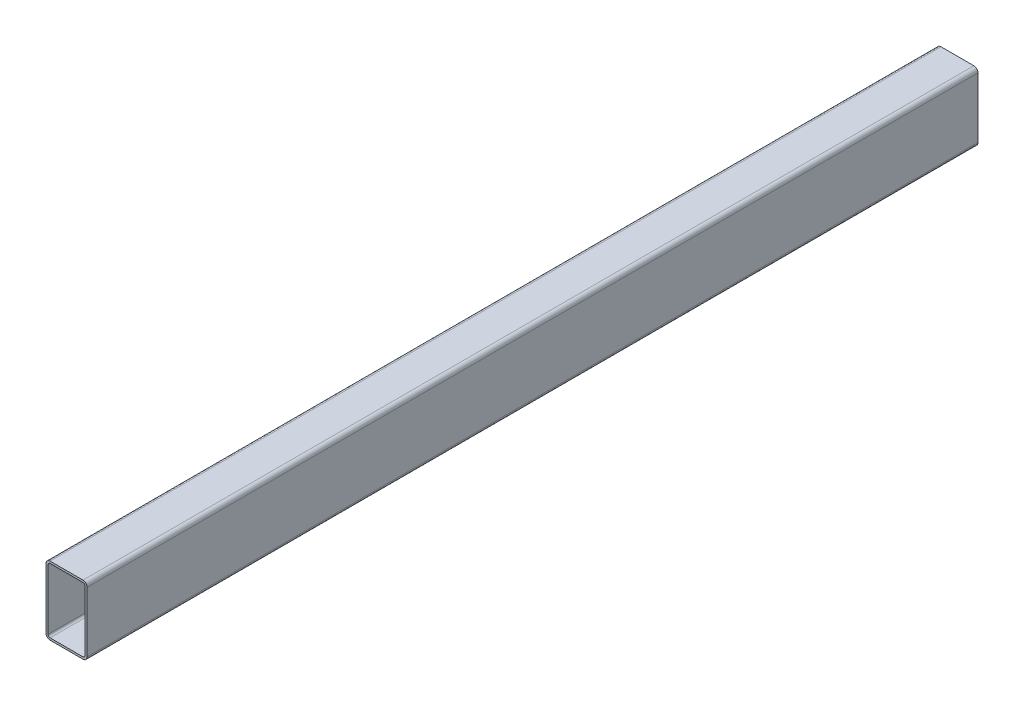
from build123d import *

# Parameters (mm, degrees)
BOSS_EXTRUDE1_DEPTH = 650


with BuildPart() as part:
    # Sketch1 → Boss-Extrude1 (new, symmetric)
    with BuildSketch(Plane.XY):
        with BuildLine():
            Line((-24, -50), (24, -50))
            ThreePointArc((24, -50), (28.242640687, -48.242640687), (30, -44))
            Line((30, -44), (30, 44))
            ThreePointArc((30, 44), (28.242640687, 48.242640687), (24, 50))
            Line((24, 50), (-24, 50))
            ThreePointArc((-24, 50), (-28.242640687, 48.242640687), (-30, 44))
            Line((-30, 44), (-30, -44))
            ThreePointArc((-30, -44), (-28.242640687, -48.242640687), (-24, -50))
        make_face()
        with BuildLine():
            Line((-24, 47), (24, 47))
            ThreePointArc((24, 47), (26.121320344, 46.121320344), (27, 44))
            Line((27, 44), (27, -44))
            ThreePointArc((27, -44), (26.121320344, -46.121320344), (24, -47))
            Line((24, -47), (-24, -47))
            ThreePointArc((-24, -47), (-26.121320344, -46.121320344), (-27, -44))
            Line((-27, -44), (-27, 44))
            ThreePointArc((-27, 44), (-26.121320344, 46.121320344), (-24, 47))
        make_face(mode=Mode.SUBTRACT)
    extrude(amount=BOSS_EXTRUDE1_DEPTH, both=True)


solid = part.part
